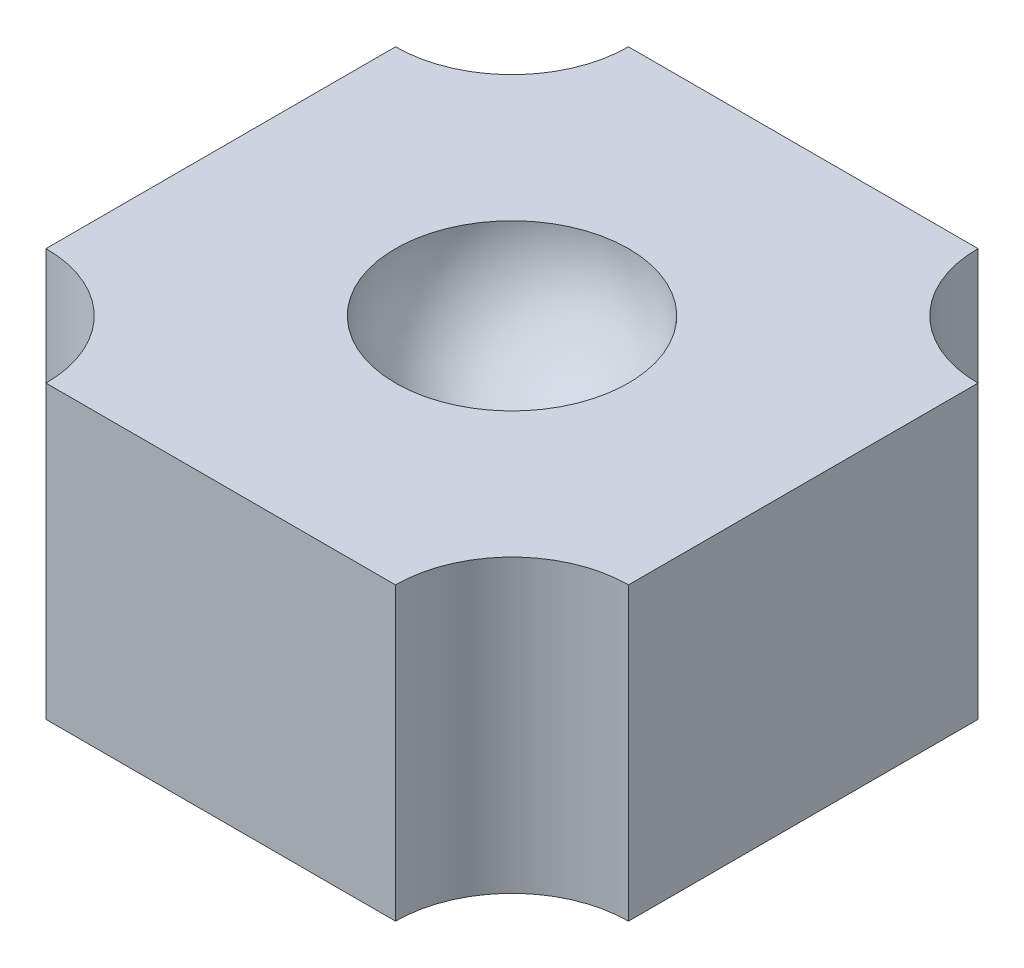
from build123d import *

# Parameters (mm, degrees)
SKETCH1_W           = 50
SKETCH1_H           = 50
BOSS_EXTRUDE1_DEPTH = 25
SKETCH2_R           = 10
CUT_EXTRUDE1_DEPTH  = 25
CUT_EXTRUDE6_DEPTH  = 8.6
CUT_EXTRUDE8_START  = -8
CUT_EXTRUDE8_DEPTH  = 24


with BuildPart() as part:
    # Sketch1 → Boss-Extrude1 (new body)
    with BuildSketch(Plane(origin=(0, 0, 0), x_dir=(1, 0, 0), z_dir=(0, 1, 0))):
        Rectangle(SKETCH1_W, SKETCH1_H)
    extrude(amount=BOSS_EXTRUDE1_DEPTH)

    # Sketch2 → Cut-Extrude1 (cut)
    with BuildSketch(Plane(origin=(0, 25, 0), x_dir=(1, 0, 0), z_dir=(0, 1, 0))):
        with Locations((-25, -25)):
            Circle(SKETCH2_R)
        with Locations((-25, 25)):
            Circle(SKETCH2_R)
        with Locations((25, 25)):
            Circle(SKETCH2_R)
        with Locations((25, -25)):
            Circle(SKETCH2_R)
    extrude(amount=-CUT_EXTRUDE1_DEPTH, mode=Mode.SUBTRACT)

    # Sketch3 → Cut-Revolve1 (revolve, cut)
    with BuildSketch(Plane(origin=(0, 25, 0), x_dir=(1, 0, 0), z_dir=(0, 1, 0))):
        with BuildLine():
            Line((0, 10), (0, -10))
            ThreePointArc((0, -10), (-10, 0), (0, 10))
        make_face()
    revolve(axis=Axis((0, 25, -10), (0, 0, 1)), mode=Mode.SUBTRACT)

    # Sketch4 → Cut-Extrude6 (cut)
    with BuildSketch(Plane(origin=(0, 0, 0), x_dir=(-1, 0, 0), z_dir=(0, -1, 0))):
        with BuildLine():
            ThreePointArc((2.5, 0), (0, 2.5), (-2.5, 0))
            Line((-2.5, 0), (2.5, 0))
        make_face()
        with BuildLine():
            Line((2.5, 0), (-2.5, 0))
            ThreePointArc((-2.5, 0), (0, -2.5), (2.5, 0))
        make_face()
        with BuildLine():
            ThreePointArc((2.5, 0), (0, -2.5), (-2.5, 0))
            Line((-2.5, 0), (-2.5, -7.669872981))
            ThreePointArc((-2.5, -7.669872981), (0, -7), (2.5, -7.669872981))
            Line((2.5, -7.669872981), (2.5, 0))
        make_face()
        with BuildLine():
            ThreePointArc((2.5, -7.669872981), (0, -7), (-2.5, -7.669872981))
            Line((-2.5, -7.669872981), (2.5, -7.669872981))
        make_face()
        with BuildLine():
            Line((2.5, -7.669872981), (-2.5, -7.669872981))
            ThreePointArc((-2.5, -7.669872981), (-2.5, -16.330127019), (5, -12))
            ThreePointArc((5, -12), (4.330127019, -9.5), (2.5, -7.669872981))
        make_face()
    extrude(amount=-CUT_EXTRUDE6_DEPTH, mode=Mode.SUBTRACT)

    # Sketch5 → Cut-Extrude8 (cut)
    with BuildSketch(Plane.XY.offset(25).offset(CUT_EXTRUDE8_START)):
        Polygon((0, 4.9), (-4, 4.9), (-4, 8.6), (4, 8.6), (4, 4.9), align=None)
    extrude(amount=-CUT_EXTRUDE8_DEPTH, mode=Mode.SUBTRACT)


solid = part.part
